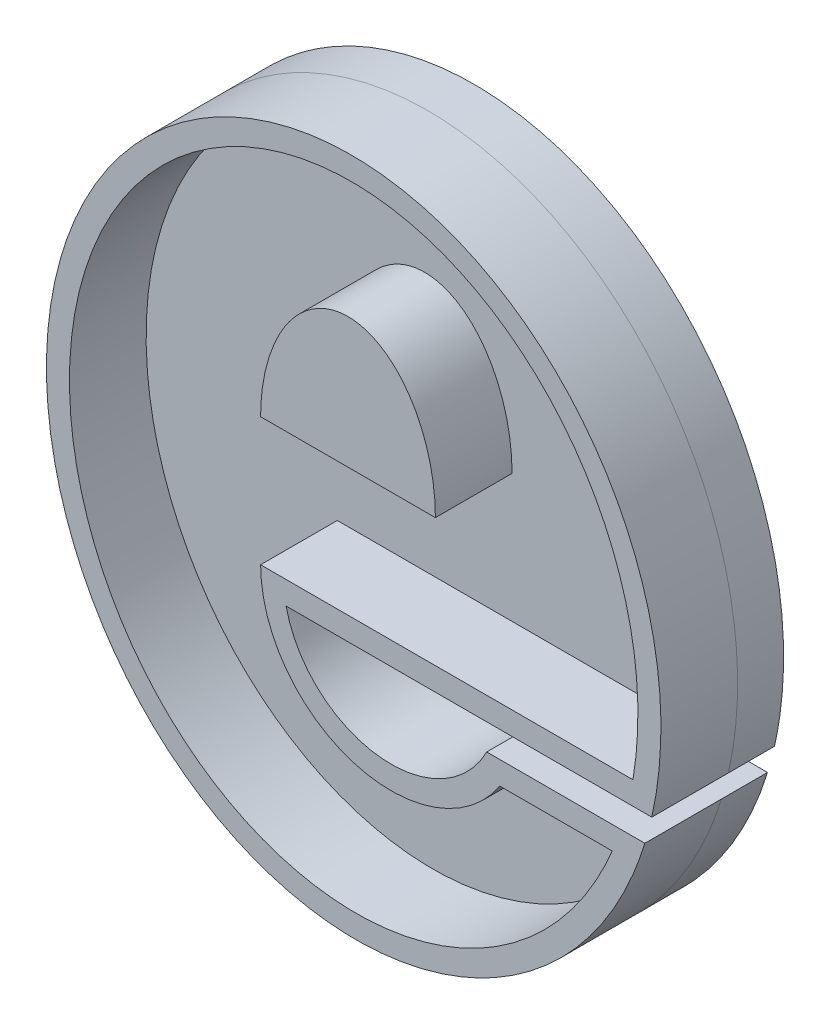
from build123d import *

# Parameters (mm, degrees)
BOSS_EXTRUDE2_DEPTH = 5
BOSS_EXTRUDE3_START = 3
BOSS_EXTRUDE3_DEPTH = 3
BOSS_EXTRUDE4_DEPTH = 8


with BuildPart() as part:
    # Sketch1 → Boss-Extrude2 (new body)
    with BuildSketch(Plane.XY):
        with BuildLine():
            Line((-4.408684648, -5.515496633), (19.441337846, -5.515496633))
            add(Edge.make_bspline(
                [(19.441337846, -5.515496633), (20.064475081, -2.769389349), (20.337172899, 2.994993976), (17.771702799, 11.208309536), (12.57821632, 17.805652598), (5.474260722, 21.791103781), (-2.491057198, 22.510408372), (-10.069086792, 19.832544712), (-16.095565796, 14.210575126), (-19.7130802, 6.52607468), (-20.435768097, -2.091727306), (-18.171138846, -10.407961028), (-13.224337424, -17.224606349), (-6.275830116, -21.520460301), (1.656480158, -22.596532939), (9.333340892, -20.262385793), (14.528390791, -15.799705467), (17.517230441, -11.156612752), (18.58052619, -8.547371421), (18.98875138, -7.215496633)],
                knots=[-1.860253864, -1.860253864, -1.860253864, -1.860253864, -1.472608589, -1.084963313, -0.697318038, -0.309672763, 0.077972513, 0.465617788, 0.853263063, 1.240908339, 1.628553614, 2.01619889, 2.403844165, 2.79148944, 3.179134716, 3.566779991, 3.954425266, 4.148247904, 4.342070542, 4.342070542, 4.342070542, 4.342070542], degree=3))
            Line((18.98875138, -7.215496633), (8.675944449, -7.215496633))
            ThreePointArc((8.675944449, -7.215496633), (1.535777598, -10.96707053), (-4.408684648, -5.515496633))
        make_face()
        with BuildLine():
            Line((-6.07105002, -4.015496633), (18.211126558, -4.015496633))
            add(Edge.make_bspline(
                [(18.211126558, -4.015496633), (23.695882723, 27.92484234), (-4.67942214, 19.962178884), (-33.054727004, 11.999515429), (-14.196717679, -13.109769213), (4.661291646, -38.219053855), (16.85858183, -8.715496633)],
                knots=[4.481150094, 4.481150094, 4.481150094, 6.495268539, 6.495268539, 8.509386984, 8.509386984, 10.523505428, 10.523505428, 10.523505428], degree=2, weights=[1, 0.534348762, 1, 0.534348762, 1, 0.534348762, 1]))
            Line((16.85858183, -8.715496633), (9.533320988, -8.715496633))
            ThreePointArc((9.533320988, -8.715496633), (-0.015332269, -12.163907437), (-6.07105002, -4.015496633))
        make_face(mode=Mode.SUBTRACT)
    extrude(amount=BOSS_EXTRUDE2_DEPTH)

    # Sketch4 → Boss-Extrude3 (add)
    with BuildSketch(Plane(origin=(0, 0, 0), x_dir=(-1, 0, 0), z_dir=(0, 0, -1)).offset(BOSS_EXTRUDE3_START)):
        with BuildLine():
            Line((-19.441337846, -5.515496633), (4.408684648, -5.515496633))
            ThreePointArc((4.408684648, -5.515496633), (-1.535777598, -10.96707053), (-8.675944449, -7.215496633))
            Line((-8.675944449, -7.215496633), (-18.98875138, -7.215496633))
            add(Edge.make_bspline(
                [(-18.98875138, -7.215496633), (-18.58052619, -8.547371421), (-17.517230441, -11.156612752), (-14.528390791, -15.799705467), (-9.333340892, -20.262385793), (-1.656480158, -22.59653294), (6.275830116, -21.520460301), (13.224337424, -17.224606349), (18.171138846, -10.407961027), (20.435768097, -2.091727306), (19.7130802, 6.52607468), (16.095565796, 14.210575126), (10.069086792, 19.832544712), (2.491057198, 22.510408372), (-5.474260722, 21.791103781), (-12.57821632, 17.805652598), (-17.771702799, 11.208309536), (-20.337172899, 2.994993976), (-20.064475081, -2.769389349), (-19.441337846, -5.515496633)],
                knots=[1.941114765, 1.941114765, 1.941114765, 1.941114765, 2.134937403, 2.328760041, 2.716405316, 3.104050591, 3.491695867, 3.879341142, 4.266986418, 4.654631693, 5.042276968, 5.429922244, 5.817567519, 6.205212795, 6.59285807, 6.980503345, 7.368148621, 7.755793896, 8.143439171, 8.143439171, 8.143439171, 8.143439171], degree=3))
        make_face()
    extrude(amount=-BOSS_EXTRUDE3_DEPTH)

    # Sketch3 → Boss-Extrude4 (add)
    with BuildSketch(Plane.XY.offset(5)):
        with BuildLine():
            Line((-6.07105002, 4.344503367), (5.32894998, 4.344503367))
            add(Edge.make_bspline(
                [(5.32894998, 4.344503367), (5.32894998, 12.854503367), (-0.37105002, 12.854503367), (-6.07105002, 12.854503367), (-6.07105002, 4.344503367)],
                knots=[4.71238898, 4.71238898, 4.71238898, 6.283185307, 6.283185307, 7.853981634, 7.853981634, 7.853981634], degree=2, weights=[1, 0.707106781, 1, 0.707106781, 1]))
        make_face()
    extrude(amount=-BOSS_EXTRUDE4_DEPTH)


solid = part.part
